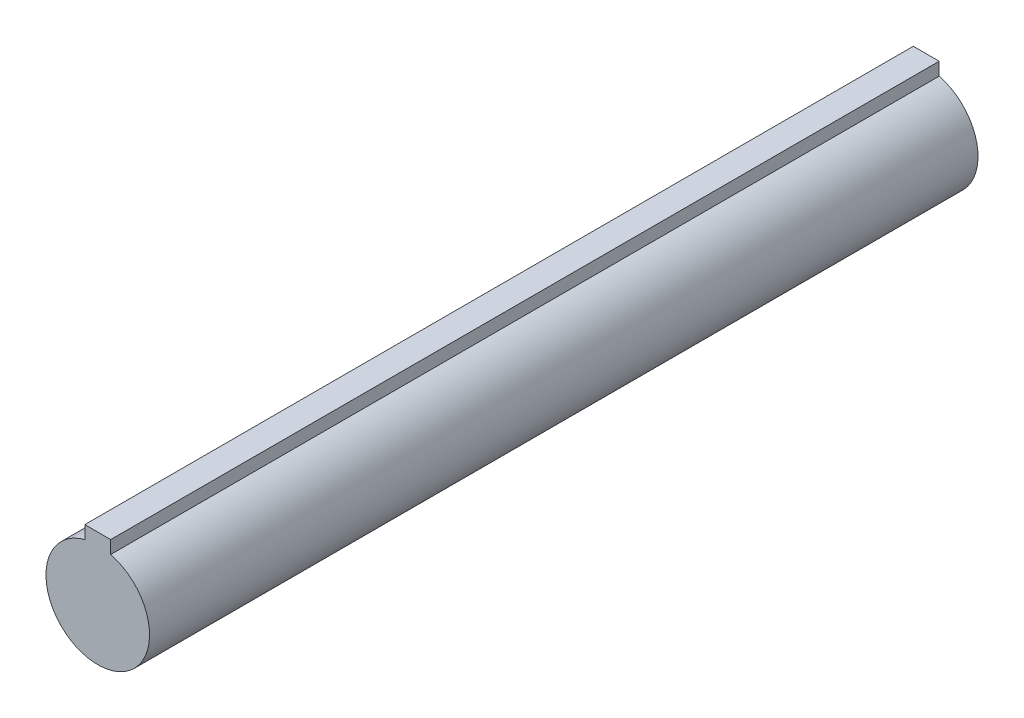
from build123d import *

# Parameters (mm, degrees)
BOSS_EXTRUDE1_DEPTH = 101.6


with BuildPart() as part:
    # Sketch1 → Boss-Extrude1 (new body)
    with BuildSketch(Plane.XY):
        with BuildLine():
            Line((-1.5875, 6.148361062), (-1.5875, 7.735861062))
            Line((-1.5875, 7.735861062), (1.5875, 7.735861062))
            Line((1.5875, 7.735861062), (1.5875, 6.148361062))
            ThreePointArc((1.5875, 6.148361062), (0, -6.35), (-1.5875, 6.148361062))
        make_face()
    extrude(amount=BOSS_EXTRUDE1_DEPTH)


solid = part.part
